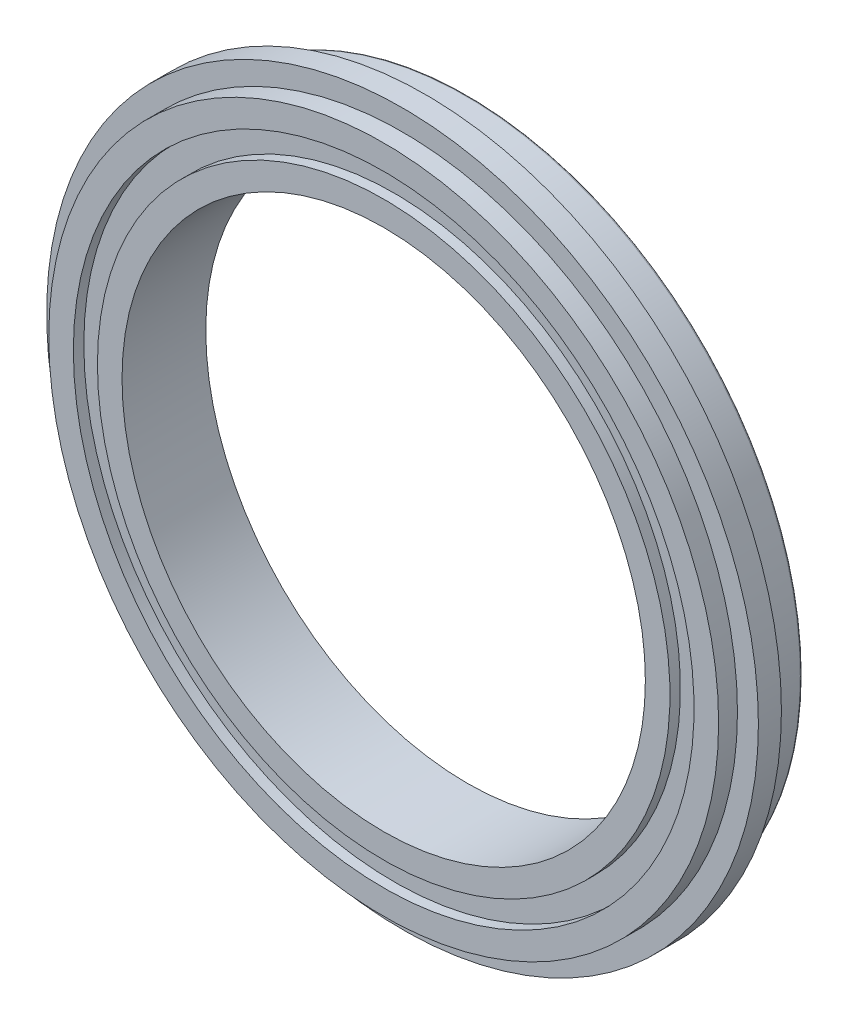
from build123d import *

# Parameters (mm, degrees)
SKETCH_1_R      = 16
SKETCH_1_R_2    = 12.5
EXTRUDE_1_DEPTH = 4
EXTRUDE_START   = -2
SKETCH_2_R      = 17
SKETCH_2_R_2    = 16
EXTRUDE_2_DEPTH = 1.1
FILLET_1_R      = 0.1
SKETCH_3_W      = 0.5
SKETCH_3_H      = 1.15


with BuildPart() as part:
    # 草图1 → 凸台-拉伸1 (new body)
    with BuildSketch(Plane.XY):
        Circle(SKETCH_1_R)
        Circle(SKETCH_1_R_2, mode=Mode.SUBTRACT)
    extrude(amount=EXTRUDE_1_DEPTH)

    # 草图2 → 凸台-拉伸2 (add)
    with BuildSketch(Plane.XY.offset(4).offset(EXTRUDE_START)):
        Circle(SKETCH_2_R)
        Circle(SKETCH_2_R_2, mode=Mode.SUBTRACT)
    extrude(amount=EXTRUDE_2_DEPTH)

    # 圆角1
    fillet_1_edges = [part.edges().sort_by_distance(p)[0] for p in [
        (-16, 0, 0),
    ]]
    fillet(fillet_1_edges, radius=FILLET_1_R)

    # 草图3 → 切除-旋转1 (revolve, cut)
    with BuildSketch(Plane(origin=(0, 0, 0), x_dir=(0, 0, -1), z_dir=(1, 0, 0)), mode=Mode.PRIVATE) as cut_revolve_1_sk:
        with Locations((-0.25, 14.25)):
            Rectangle(SKETCH_3_W, SKETCH_3_H)
        with Locations((-2.85, 14.25)):
            Rectangle(SKETCH_3_W, SKETCH_3_H)
    cut_revolve_1 = revolve(cut_revolve_1_sk.sketch.rotate(Axis((0, 0, 0), (0, 0, 1)), 90), axis=Axis((0, 0, 0), (0, 0, 1)), mode=Mode.SUBTRACT)

    # 镜向1: 切除-旋转1 across plane
    add(cut_revolve_1.mirror(Plane(origin=(0, 0, 2), x_dir=(1, 0, 0), z_dir=(0, 0, -1))), mode=Mode.SUBTRACT)


solid = part.part
